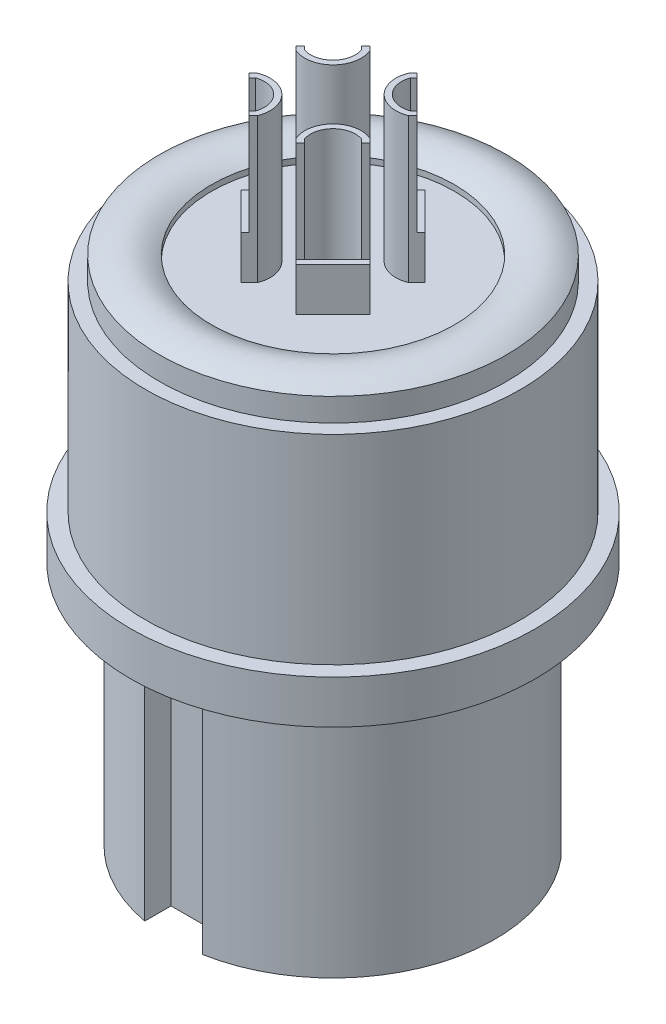
from build123d import *

# Parameters (mm, degrees)
SKETCH_2_R          = 0.45
EXTRUDE_1_DEPTH     = 5
SKETCH_4_R          = 3.666187069
CUT_EXTRUDE_1_DEPTH = 3.5
SKETCH_5_R          = 0.495
EXTRUDE_2_DEPTH     = 6.6
SKETCH_6_R          = 9.064865096
CUT_EXTRUDE_2_DEPTH = 8


with BuildPart() as part:
    # Эскиз2 → Повернуть1 (revolve)
    with BuildSketch(Plane.XY, mode=Mode.PRIVATE) as revolve_1_sk:
        with Locations((-6.06, 0.542496697)):
            Circle(SKETCH_2_R)
        with BuildLine():
            Line((0, 9.402496697), (-4.2, 9.402496697))
            Line((-4.2, 9.402496697), (-4.2, 9.602496697))
            add(Edge.make_bspline(
                [(-6, 9.602496697), (-5.1, 10.202496697), (-4.2, 9.602496697)],
                knots=[0, 0, 0, 1, 1, 1], degree=2))
            Line((-6, 9.602496697), (-6, 8.802496697))
            Line((-6, 8.802496697), (-6.48, 8.802496697))
            Line((-6.48, 8.802496697), (-6.48, 1.902496697))
            Line((-6.48, 1.902496697), (-7, 1.902496697))
            Line((-7, 1.902496697), (-7, 0.402496697))
            Line((-7, 0.402496697), (-6.52, 0.402496697))
            Line((-6.52, 0.402496697), (-6.52, 1.002496697))
            Line((-6.52, 1.002496697), (-5.6, 1.002496697))
            Line((-5.6, 1.002496697), (-5.6, -8.097503303))
            Line((-5.6, -8.097503303), (-4.5, -8.097503303))
            Line((-4.5, -8.097503303), (-4.5, 0.002496697))
            Line((-4.5, 0.002496697), (0, 0.002496697))
            Line((0, 0.002496697), (0, 9.402496697))
        make_face()
    revolve(revolve_1_sk.sketch.rotate(Axis((0, -18.016016449, 0), (0, 1, 0)), 270), axis=Axis((0, -18.016016449, 0), (0, 1, 0)))

    # Эскиз3 → Бобышка-Вытянуть1 (add)
    # profile 1 of 4: a face of its own
    with BuildSketch(Plane(origin=(0, 9.402496697, 0), x_dir=(1, 0, 0), z_dir=(0, 1, 0))):
        with BuildLine():
            Line((0.954594155, 2.227386361), (2.227386361, 0.954594155))
            Line((2.227386361, 0.954594155), (1.944543648, 0.671751442))
            ThreePointArc((1.944543648, 0.671751442), (0.883883476, 0.883883476), (0.671751442, 1.944543648))
            Line((0.671751442, 1.944543648), (0.954594155, 2.227386361))
        make_face()
        with BuildLine():
            Line((0.954594155, 1.944543648), (0.843151745, 1.833101238))
            ThreePointArc((0.843151745, 1.833101238), (1.025304833, 1.025304833), (1.833101238, 0.843151745))
            Line((1.833101238, 0.843151745), (1.944543648, 0.954594155))
            Line((1.944543648, 0.954594155), (0.954594155, 1.944543648))
        make_face(mode=Mode.SUBTRACT)
    # profile 2 of 4: a face of its own
    with BuildSketch(Plane(origin=(0, 9.402496697, 0), x_dir=(1, 0, 0), z_dir=(0, 1, 0))):
        with BuildLine():
            Line((2.227386361, -0.954594155), (1.944543648, -0.671751442))
            ThreePointArc((1.944543648, -0.671751442), (0.883883476, -0.883883476), (0.671751442, -1.944543648))
            Line((0.671751442, -1.944543648), (0.954594155, -2.227386361))
            Line((0.954594155, -2.227386361), (2.227386361, -0.954594155))
        make_face()
        with BuildLine():
            Line((1.944543648, -0.954594155), (0.954594155, -1.944543648))
            Line((0.954594155, -1.944543648), (0.843151745, -1.833101238))
            ThreePointArc((0.843151745, -1.833101238), (1.025304833, -1.025304833), (1.833101238, -0.843151745))
            Line((1.833101238, -0.843151745), (1.944543648, -0.954594155))
        make_face(mode=Mode.SUBTRACT)
    # profile 3 of 4: a face of its own
    with BuildSketch(Plane(origin=(0, 9.402496697, 0), x_dir=(1, 0, 0), z_dir=(0, 1, 0))):
        with BuildLine():
            Line((-0.954594155, -2.227386361), (-0.671751442, -1.944543648))
            ThreePointArc((-0.671751442, -1.944543648), (-0.883883476, -0.883883476), (-1.944543648, -0.671751442))
            Line((-1.944543648, -0.671751442), (-2.227386361, -0.954594155))
            Line((-2.227386361, -0.954594155), (-0.954594155, -2.227386361))
        make_face()
        with BuildLine():
            Line((-0.954594155, -1.944543648), (-1.944543648, -0.954594155))
            Line((-1.944543648, -0.954594155), (-1.833101238, -0.843151745))
            ThreePointArc((-1.833101238, -0.843151745), (-1.025304833, -1.025304833), (-0.843151745, -1.833101238))
            Line((-0.843151745, -1.833101238), (-0.954594155, -1.944543648))
        make_face(mode=Mode.SUBTRACT)
    # profile 4 of 4: a face of its own
    with BuildSketch(Plane(origin=(0, 9.402496697, 0), x_dir=(1, 0, 0), z_dir=(0, 1, 0))):
        with BuildLine():
            Line((-2.227386361, 0.954594155), (-1.944543648, 0.671751442))
            ThreePointArc((-1.944543648, 0.671751442), (-0.883883476, 0.883883476), (-0.671751442, 1.944543648))
            Line((-0.671751442, 1.944543648), (-0.954594155, 2.227386361))
            Line((-0.954594155, 2.227386361), (-2.227386361, 0.954594155))
        make_face()
        with BuildLine():
            Line((-1.944543648, 0.954594155), (-0.954594155, 1.944543648))
            Line((-0.954594155, 1.944543648), (-0.843151745, 1.833101238))
            ThreePointArc((-0.843151745, 1.833101238), (-1.025304833, 1.025304833), (-1.833101238, 0.843151745))
            Line((-1.833101238, 0.843151745), (-1.944543648, 0.954594155))
        make_face(mode=Mode.SUBTRACT)
    extrude(amount=EXTRUDE_1_DEPTH)

    # Эскиз4 → Вырез-Вытянуть1 (cut)
    with BuildSketch(Plane(origin=(0, 14.402496697, 0), x_dir=(1, 0, 0), z_dir=(0, 1, 0))):
        Circle(SKETCH_4_R)
        Polygon((0, -2.899137803), (2.899137803, 0), (0, 2.899137803), (-2.899137803, 0), align=None, mode=Mode.SUBTRACT)
    extrude(amount=-CUT_EXTRUDE_1_DEPTH, mode=Mode.SUBTRACT)

    # Эскиз5 → Бобышка-Вытянуть2 (add)
    with BuildSketch(Plane.XZ.offset(-0.002496697)):
        with Locations(Location((1.590990258, 1.590990258, 0), (0, 0, 90))):
            Circle(SKETCH_5_R)
        with Locations(Location((1.590990258, -1.590990258, 0), (0, 0, 90))):
            Circle(SKETCH_5_R)
        with Locations(Location((-1.590990258, -1.590990258, 0), (0, 0, 90))):
            Circle(SKETCH_5_R)
        with Locations(Location((-1.590990258, 1.590990258, 0), (0, 0, 90))):
            Circle(SKETCH_5_R)
    extrude(amount=EXTRUDE_2_DEPTH)

    # Эскиз6 → Вырез-Вытянуть2 (cut)
    with BuildSketch(Plane.XZ.offset(8.097503303)):
        Circle(SKETCH_6_R)
        with BuildLine():
            Line((-1, 4.6), (1, 4.6))
            Line((1, 4.6), (1, 6.6))
            ThreePointArc((1, 6.6), (6.259098002, 2.320278475), (5.060463205, -4.353356424))
            Line((5.060463205, -4.353356424), (3.606244584, -2.899137803))
            Line((3.606244584, -2.899137803), (2.899137803, -3.606244584))
            Line((2.899137803, -3.606244584), (4.353356424, -5.060463205))
            ThreePointArc((4.353356424, -5.060463205), (0, -6.675327707), (-4.353356424, -5.060463205))
            Line((-4.353356424, -5.060463205), (-2.899137803, -3.606244584))
            Line((-2.899137803, -3.606244584), (-3.606244584, -2.899137803))
            Line((-3.606244584, -2.899137803), (-5.060463205, -4.353356424))
            ThreePointArc((-5.060463205, -4.353356424), (-6.259098002, 2.320278475), (-1, 6.6))
            Line((-1, 6.6), (-1, 4.6))
        make_face(mode=Mode.SUBTRACT)
    extrude(amount=-CUT_EXTRUDE_2_DEPTH, mode=Mode.SUBTRACT)


solid = part.part
